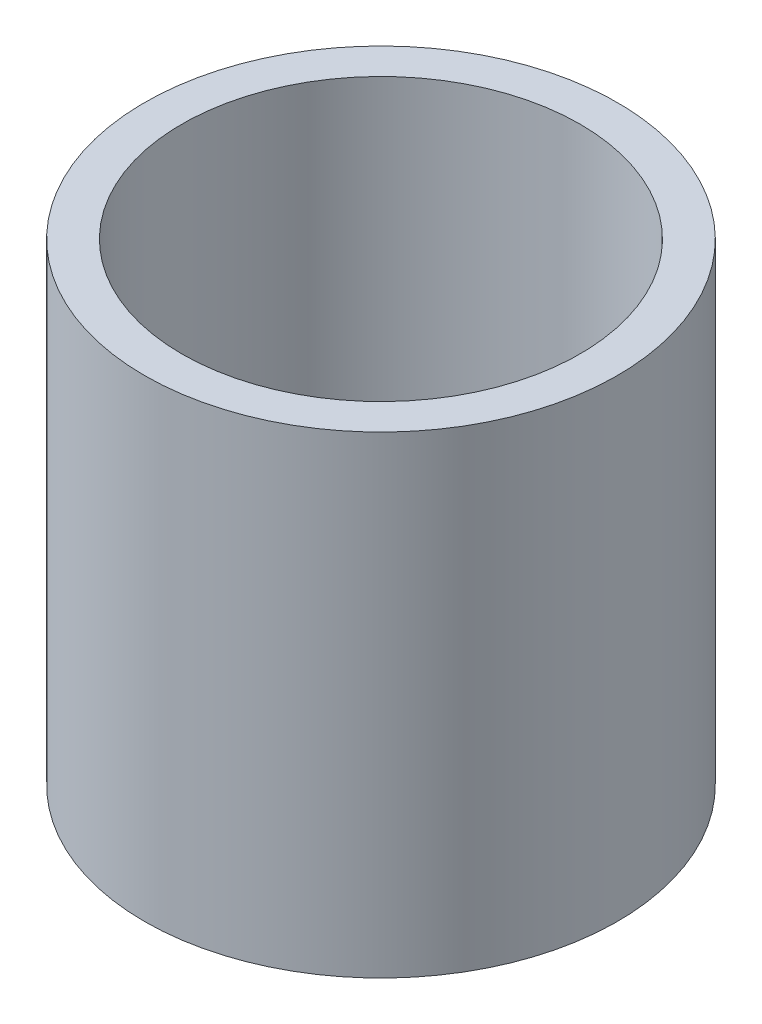
from build123d import *

# Parameters (mm, degrees)
SKETCH_1_R      = 9.5
SKETCH_1_R_2    = 8
EXTRUDE_1_DEPTH = 19


with BuildPart() as part:
    # 草图1 → 凸台-拉伸1 (new body)
    with BuildSketch(Plane(origin=(0, 0, 0), x_dir=(1, 0, 0), z_dir=(0, 1, 0))):
        with Locations(Location((0, 0, 0), (0, 0, 270))):
            Circle(SKETCH_1_R)
        with Locations(Location((0, 0, 0), (0, 0, 270))):
            Circle(SKETCH_1_R_2, mode=Mode.SUBTRACT)
    extrude(amount=EXTRUDE_1_DEPTH)


solid = part.part
